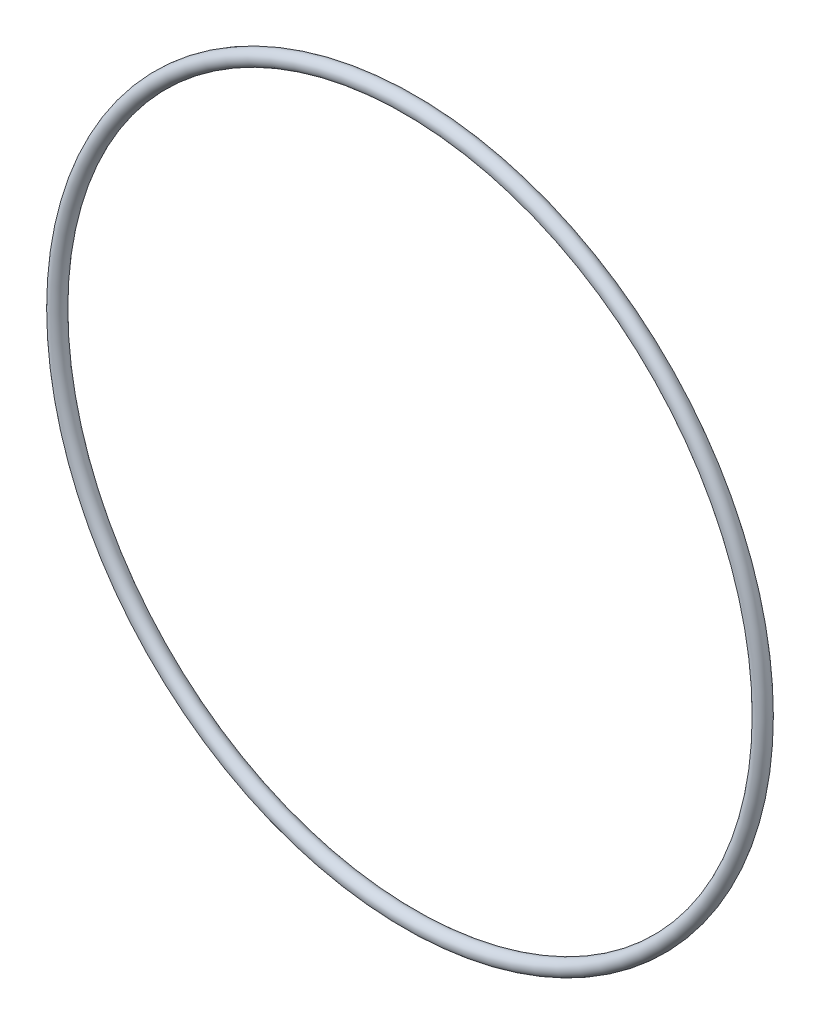
from build123d import *

# Parameters (mm, degrees)
SKETCH3_R = 1.3081


with BuildPart() as part:
    # Sketch3 → Revolve1 (revolve)
    with BuildSketch(Plane(origin=(0, 0, 0), x_dir=(0, 0, -1), z_dir=(1, 0, 0)), mode=Mode.PRIVATE) as revolve1_sk:
        with Locations((0, -61.468)):
            Circle(SKETCH3_R)
    revolve(revolve1_sk.sketch.rotate(Axis((0, 0, -1.3081), (0, 0, 1)), 270), axis=Axis((0, 0, -1.3081), (0, 0, 1)))


solid = part.part
